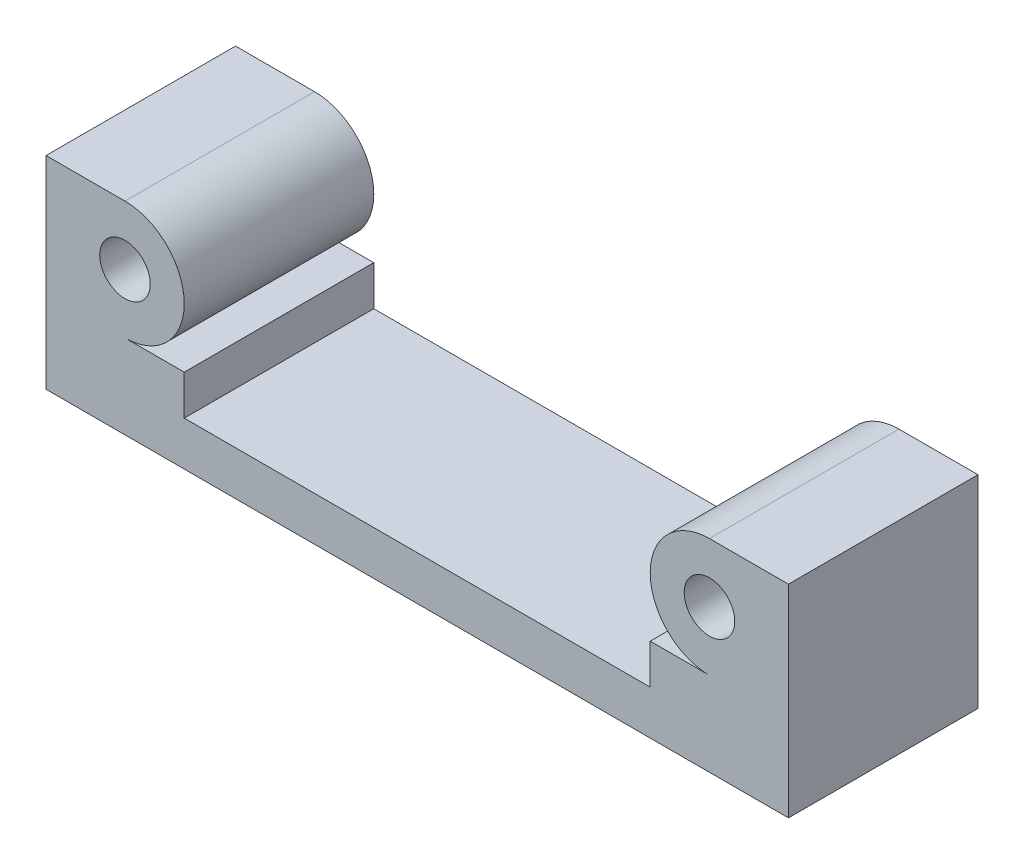
from build123d import *

# Parameters (mm, degrees)
SKETCH1_R           = 1.6
BOSS_EXTRUDE1_DEPTH = 12


with BuildPart() as part:
    # Sketch1 → Boss-Extrude1 (new body)
    with BuildSketch(Plane.XY):
        with BuildLine():
            ThreePointArc((-3.75, 2.523123532), (0, 6.273123532), (-3.75, 10.023123532))
            Line((-3.75, 10.023123532), (-8.75, 10.023123532))
            Line((-8.75, 10.023123532), (-8.75, -2.792382112))
            Line((-8.75, -2.792382112), (38.25, -2.792382112))
            Line((38.25, -2.792382112), (38.25, 10.023123532))
            Line((38.25, 10.023123532), (33.25, 10.023123532))
            ThreePointArc((33.25, 10.023123532), (29.5, 6.273123532), (33.25, 2.523123532))
            Line((33.25, 2.523123532), (29.5, 2.523123532))
            Line((29.5, 2.523123532), (29.5, 0))
            Line((29.5, 0), (0, 0))
            Line((0, 0), (0, 2.523123532))
            Line((0, 2.523123532), (-3.75, 2.523123532))
        make_face()
        with Locations(Location((-3.75, 6.273123532, 0), (0, 0, 180))):
            Circle(SKETCH1_R, mode=Mode.SUBTRACT)
        with Locations(Location((33.25, 6.273123532, 0), (0, 0, 180))):
            Circle(SKETCH1_R, mode=Mode.SUBTRACT)
    extrude(amount=BOSS_EXTRUDE1_DEPTH)


solid = part.part
